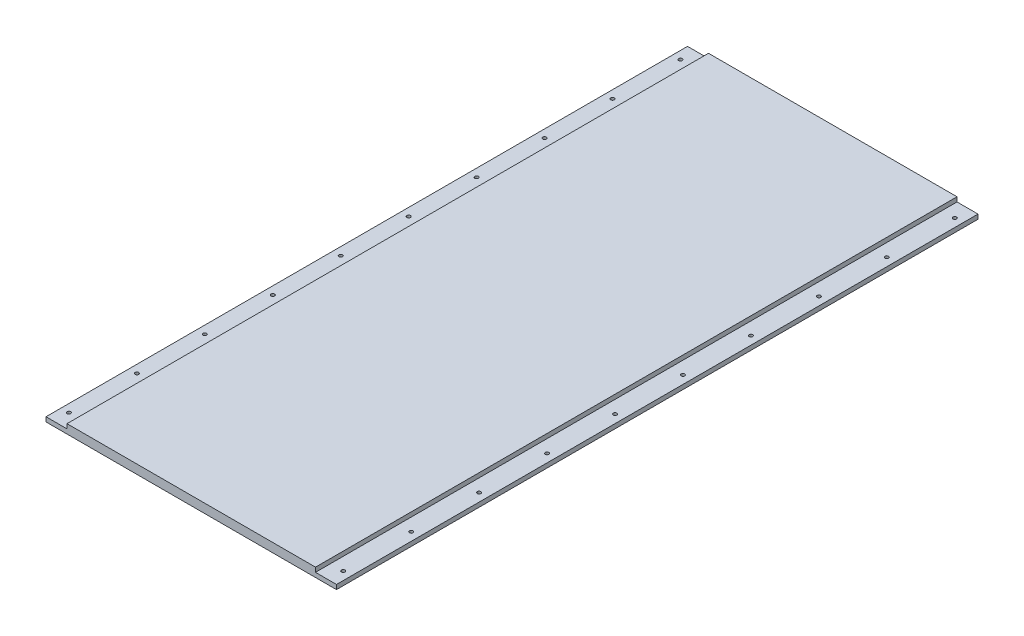
from build123d import *

# Parameters (mm, degrees)
SKETCH1_W                 = 96.9
SKETCH1_H                 = 214
BOSS_EXTRUDE1_DEPTH       = 3
SKETCH2_W                 = 7
SKETCH2_H                 = 214
CUT_EXTRUDE1_DEPTH        = 1.5
F_0_80_TAPPED_HOLE1_D     = 1.19126
F_0_80_TAPPED_HOLE1_DEPTH = 4.0005
F_0_80_TAPPED_HOLE1_TIP   = 0.357890611


with BuildPart() as part:
    # Sketch1 → Boss-Extrude1 (new body)
    with BuildSketch(Plane(origin=(0, 0, 0), x_dir=(1, 0, 0), z_dir=(0, 1, 0))):
        Rectangle(SKETCH1_W, SKETCH1_H)
    extrude(amount=BOSS_EXTRUDE1_DEPTH)

    # Sketch2 → Cut-Extrude1 (cut)
    with BuildSketch(Plane(origin=(0, 3, 0), x_dir=(1, 0, 0), z_dir=(0, 1, 0))):
        with Locations((44.95, 0)):
            Rectangle(SKETCH2_W, SKETCH2_H)
        with Locations((-44.95, 0)):
            Rectangle(SKETCH2_W, SKETCH2_H)
    extrude(amount=-CUT_EXTRUDE1_DEPTH, mode=Mode.SUBTRACT)

    # #0-80 Tapped Hole1
    with Locations(Plane(origin=(0, 3, 0), x_dir=(1, 0, 0), z_dir=(0, 1, 0))):
        with Locations((45.7, -102), (-45.8, -102), (45.7, -79.333333333), (-45.8, -79.333333333), (45.7, -56.666666667), (-45.8, -56.666666667), (45.7, -34), (-45.8, -34), (45.7, -11.333333333), (-45.8, -11.333333333), (45.7, 11.333333333), (-45.8, 11.333333333), (45.7, 34), (-45.8, 34), (45.7, 56.666666667), (-45.8, 56.666666667), (45.7, 79.333333333), (-45.8, 79.333333333), (45.7, 102), (-45.8, 102)):
            Hole(F_0_80_TAPPED_HOLE1_D / 2, depth=F_0_80_TAPPED_HOLE1_DEPTH)
            with Locations((0, 0, -(F_0_80_TAPPED_HOLE1_DEPTH + F_0_80_TAPPED_HOLE1_TIP / 2))):  # 118° drill point
                Cone(0, F_0_80_TAPPED_HOLE1_D / 2, F_0_80_TAPPED_HOLE1_TIP, mode=Mode.SUBTRACT)


solid = part.part
